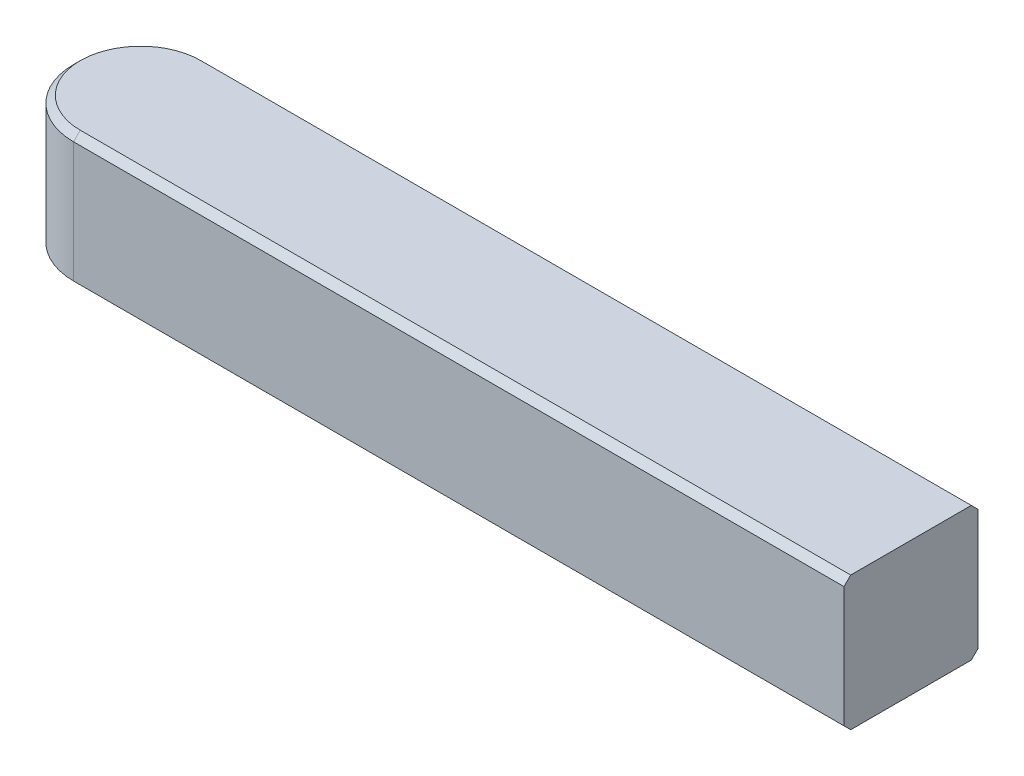
from build123d import *

# Parameters (mm, degrees)
SKETCH1_W           = 25
SKETCH1_H           = 4
BOSS_EXTRUDE1_DEPTH = 4
FILLET1_RADIUS      = 2
FILLET1_LENGTH      = 4
CHAMFER1_SIZE       = 0.2


with BuildPart() as part:
    # Sketch1 → Boss-Extrude1 (new body)
    with BuildSketch(Plane(origin=(0, 0, 0), x_dir=(1, 0, 0), z_dir=(0, 1, 0))):
        with Locations((12.5, 0)):
            Rectangle(SKETCH1_W, SKETCH1_H)
    extrude(amount=BOSS_EXTRUDE1_DEPTH)

    # Fillet1: full round fillet: the end face becomes a half cylinder, R = half its width
    fillet1_face = Plane((0, 2, 0), x_dir=(0, -1, 0), z_dir=(-1, 0, 0))  # on the end face: x along it, z out of the body
    fillet1_slab = fillet1_face.offset(-FILLET1_RADIUS / 2) * Box(FILLET1_LENGTH, 2 * FILLET1_RADIUS, FILLET1_RADIUS, mode=Mode.PRIVATE)  # the body's end, R deep
    fillet1_round = Plane((2, 2, 0), x_dir=(-1, 0, 0), z_dir=(0, -1, 0)) * Cylinder(FILLET1_RADIUS, FILLET1_LENGTH, mode=Mode.PRIVATE)  # its axis R under the face
    add(fillet1_slab - fillet1_round, mode=Mode.SUBTRACT)

    # Chamfer1
    chamfer1_edges = [part.edges().sort_by_distance(p)[0] for p in [
        (13.5, 4, -2),
        (13.5, 0, 2),
        (13.5, 4, 2),
        (0, 0, 0),
        (0, 4, 0),
        (13.5, 0, -2),
    ]]
    chamfer(chamfer1_edges, length=CHAMFER1_SIZE)


solid = part.part
